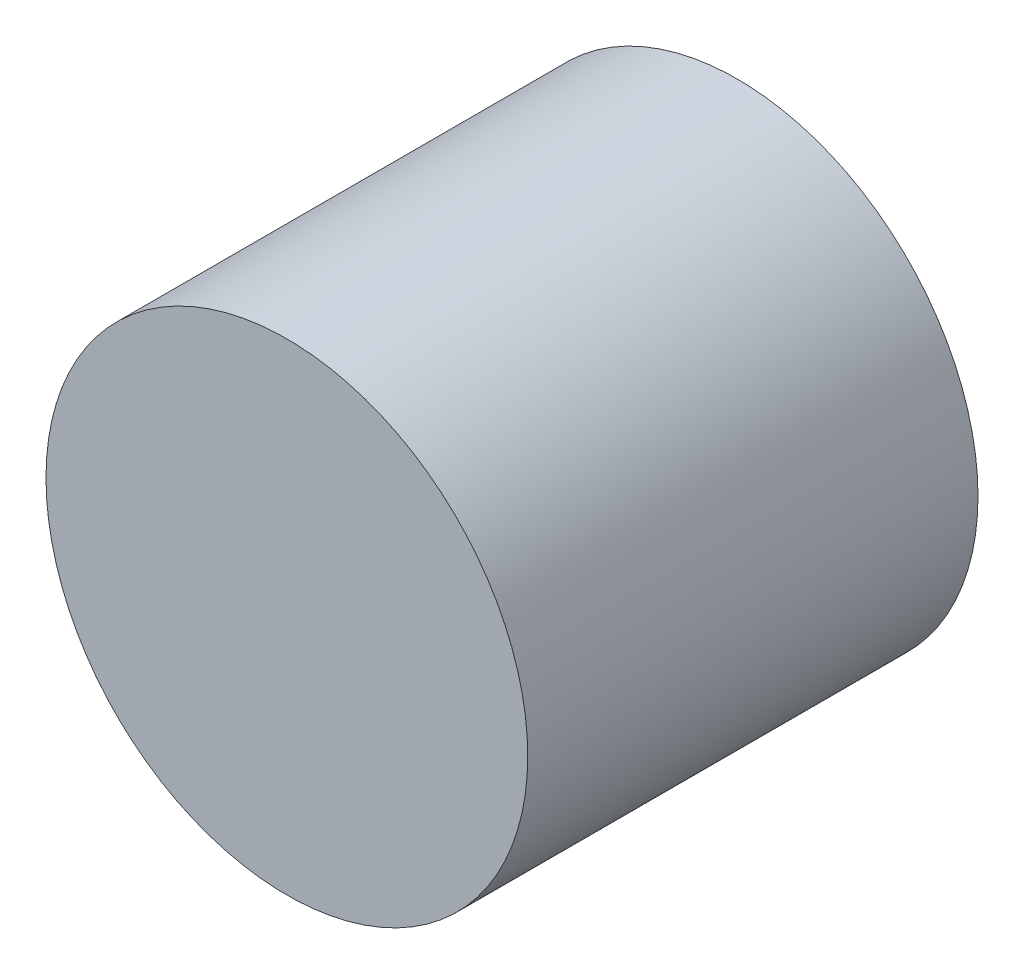
from build123d import *

# Parameters (mm, degrees)
SKETCH1_R           = 95.123
BOSS_EXTRUDE1_DEPTH = 177.8


with BuildPart() as part:
    # Sketch1 → Boss-Extrude1 (new body)
    with BuildSketch(Plane.XY):
        Circle(SKETCH1_R)
    extrude(amount=BOSS_EXTRUDE1_DEPTH)


solid = part.part
